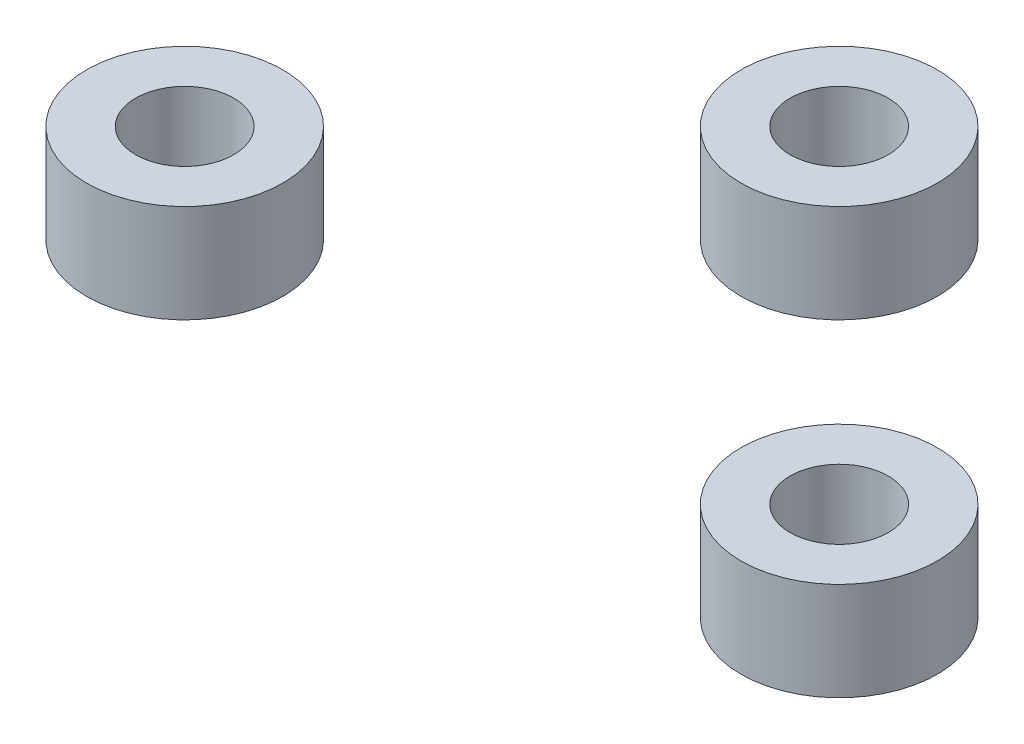
from build123d import *

# Parameters (mm, degrees)
SKETCH1_R             = 30
SKETCH1_R_2           = 15
BOSS_EXTRUDE1_DEPTH   = 30
BOSS_EXTRUDE1_2_DEPTH = 30
BOSS_EXTRUDE1_3_DEPTH = 30


with BuildPart() as part:
    # Sketch1 → Boss-Extrude1 (new body)
    with BuildSketch(Plane(origin=(0, 0, 0), x_dir=(1, 0, 0), z_dir=(0, 1, 0))):
        with Locations(Location((200, 0, 0), (0, 0, 270))):
            Circle(SKETCH1_R)
        with Locations(Location((200, 0, 0), (0, 0, 270))):
            Circle(SKETCH1_R_2, mode=Mode.SUBTRACT)
    extrude(amount=BOSS_EXTRUDE1_DEPTH)


with BuildPart() as body_2:
    # Sketch1 → Boss-Extrude1 2 (new body)
    with BuildSketch(Plane(origin=(0, 0, 0), x_dir=(1, 0, 0), z_dir=(0, 1, 0))):
        with Locations(Location((100, 100, 0), (0, 0, 270))):
            Circle(SKETCH1_R)
        with Locations(Location((100, 100, 0), (0, 0, 270))):
            Circle(SKETCH1_R_2, mode=Mode.SUBTRACT)
    extrude(amount=BOSS_EXTRUDE1_2_DEPTH)


with BuildPart() as body_3:
    # Sketch1 → Boss-Extrude1 3 (new body)
    with BuildSketch(Plane(origin=(0, 0, 0), x_dir=(1, 0, 0), z_dir=(0, 1, 0))):
        with Locations(Location((0, 0, 0), (0, 0, 270))):
            Circle(SKETCH1_R)
        with Locations(Location((0, 0, 0), (0, 0, 270))):
            Circle(SKETCH1_R_2, mode=Mode.SUBTRACT)
    extrude(amount=BOSS_EXTRUDE1_3_DEPTH)


solid = Compound([part.part, body_2.part, body_3.part])
